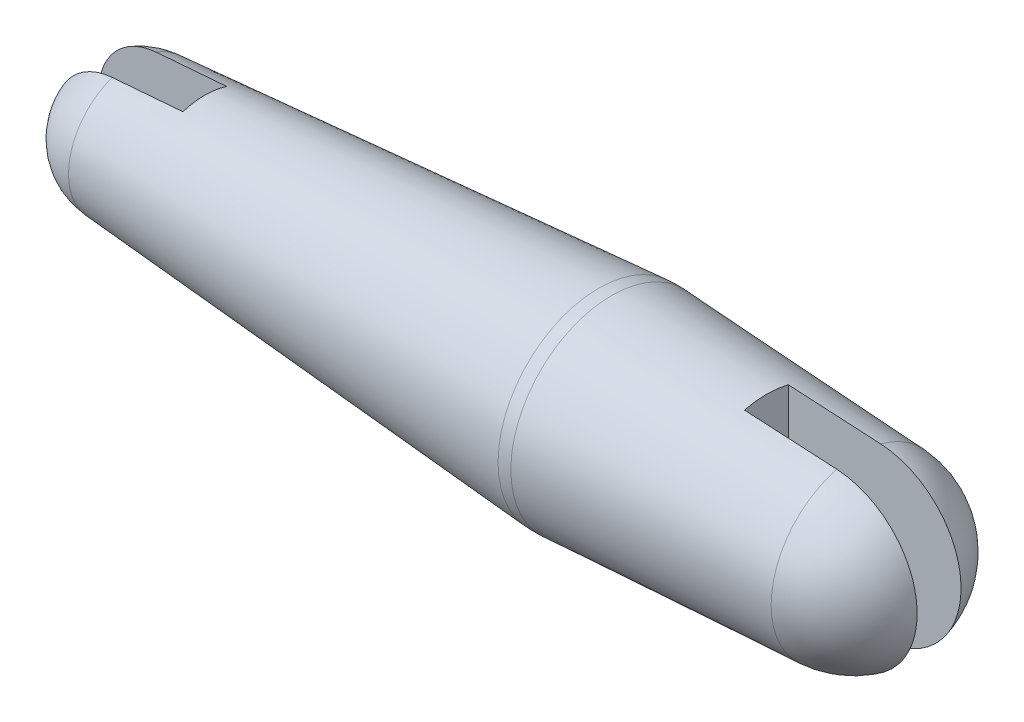
from build123d import *

# Parameters (mm, degrees)
CUT_EXTRUDE1_DEPTH      = 271.724562794
CUT_EXTRUDE1_DEPTH_BACK = 271.724562794
SKETCH2_W               = 101.6
SKETCH2_H               = 25.4
SKETCH2_W_2             = 76.2


with BuildPart() as part:
    # Sketch1 → Revolve1 (revolve)
    with BuildSketch(Plane.XY):
        with BuildLine():
            Line((-207.01, 0), (207.01, 0))
            Line((207.01, 0), (257.81, 0))
            ThreePointArc((257.81, 0), (243.872346186, 34.954362155), (209.707345133, 50.728338522))
            Line((209.707345133, 50.728338522), (66.601946903, 58.337589301))
            ThreePointArc((66.601946903, 58.337589301), (62.855469091, 58.416444431), (59.111643192, 58.254945923))
            Line((59.111643192, 58.254945923), (-209.871971831, 37.992356037))
            ThreePointArc((-209.871971831, 37.992356037), (-234.944307999, 25.909157389), (-245.11, 0))
            Line((-245.11, 0), (-207.01, 0))
        make_face()
    revolve(axis=Axis((-207.01, 0, 0), (1, 0, 0)))

    # Sketch2 → Cut-Extrude1 (cut, two sides: drawn at the far end of the back side and taken through both)
    with BuildSketch(Plane(origin=(0, 0, 0), x_dir=(1, 0, 0), z_dir=(0, 1, 0)).offset(-CUT_EXTRUDE1_DEPTH_BACK)):
        with Locations((207.01, 0)):
            Rectangle(SKETCH2_W, SKETCH2_H)
        with Locations((-207.01, 0)):
            Rectangle(SKETCH2_W_2, SKETCH2_H)
    extrude(amount=CUT_EXTRUDE1_DEPTH + CUT_EXTRUDE1_DEPTH_BACK, mode=Mode.SUBTRACT)


solid = part.part
